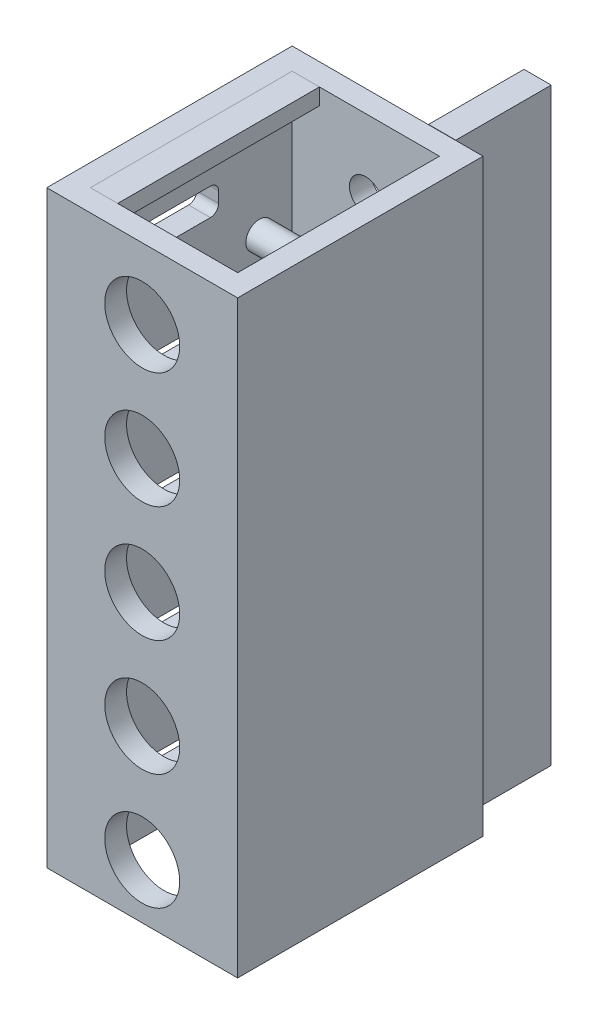
from build123d import *

# Parameters (mm, degrees)
SKETCH2_W           = 35
SKETCH2_H           = 105
BOSS_EXTRUDE1_DEPTH = 45
CUT_EXTRUDE1_REACH  = 133.011
SKETCH3_W           = 27
SKETCH3_H           = 37
SKETCH4_R           = 6.875
CUT_EXTRUDE2_DEPTH  = 10
SKETCH14_R          = 2.5
BOSS_EXTRUDE2_DEPTH = 10
CUT_EXTRUDE7_START  = -3.5
SKETCH15_R          = 2.5
SKETCH15_R_2        = 1.75
CUT_EXTRUDE7_DEPTH  = 1.5
SKETCH16_W          = 37
SKETCH16_H          = 3
BOSS_EXTRUDE4_DEPTH = 5
SKETCH17_W          = 35
SKETCH17_H          = 45
SKETCH17_W_2        = 27
SKETCH17_H_2        = 37
BOSS_EXTRUDE5_DEPTH = 3
SKETCH18_R          = 3
CUT_EXTRUDE8_DEPTH  = 10
CUT_EXTRUDE9_START  = -30
CUT_EXTRUDE9_DEPTH  = 10
SKETCH19_W          = 5
SKETCH19_H          = 108.046697757
BOSS_EXTRUDE6_DEPTH = 17.5


with BuildPart() as part:
    # Sketch2 → Boss-Extrude1 (new body)
    with BuildSketch(Plane.XY):
        with Locations((-46.639483312, 26.893418081)):
            Rectangle(SKETCH2_W, SKETCH2_H)
    extrude(amount=-BOSS_EXTRUDE1_DEPTH)

    # Sketch3 → Cut-Extrude1 (cut, up to next)
    with BuildSketch(Plane(origin=(0, 79.393418081, 0), x_dir=(1, 0, 0), z_dir=(0, 1, 0)), mode=Mode.PRIVATE) as cut_extrude1_sk1:
        with Locations((-46.639483312, 22.5)):
            Rectangle(SKETCH3_W, SKETCH3_H)
    cut_extrude1_tool1 = extrude(cut_extrude1_sk1.sketch, amount=-CUT_EXTRUDE1_REACH, mode=Mode.PRIVATE) & part.part
    add(cut_extrude1_tool1.solids().sort_by_distance((-46.639483, 79.393418, -22.5))[0], mode=Mode.SUBTRACT)

    # Sketch4 → Cut-Extrude2 (cut)
    with BuildSketch(Plane.XY):
        with Locations((-46.639483312, 69.393418081)):
            Circle(SKETCH4_R)
        with Locations((-46.639483312, 48.143418081)):
            Circle(SKETCH4_R)
        with Locations((-46.639483312, 26.893418081)):
            Circle(SKETCH4_R)
        with Locations((-46.639483312, 5.643418081)):
            Circle(SKETCH4_R)
        with Locations((-46.639483312, -15.606581919)):
            Circle(SKETCH4_R)
    extrude(amount=-CUT_EXTRUDE2_DEPTH, mode=Mode.SUBTRACT)

    # Sketch14 → Boss-Extrude2 (add)
    with BuildSketch(Plane(origin=(-60.139483312, 0, 0), x_dir=(0, 0, -1), z_dir=(1, 0, 0))):
        with Locations(Location((35, 59.393418081, 0), (0, 0, 270))):
            Circle(SKETCH14_R)
    extrude(amount=BOSS_EXTRUDE2_DEPTH)

    # Sketch15 → Cut-Extrude7 (cut)
    with BuildSketch(Plane(origin=(-50.139483312, 0, 0), x_dir=(0, 0, -1), z_dir=(1, 0, 0)).offset(CUT_EXTRUDE7_START)):
        with Locations(Location((35, 59.393418081, 0), (0, 0, 270))):
            Circle(SKETCH15_R)
        with Locations(Location((35, 59.393418081, 0), (0, 0, 90))):
            Circle(SKETCH15_R_2, mode=Mode.SUBTRACT)
    extrude(amount=CUT_EXTRUDE7_DEPTH, mode=Mode.SUBTRACT)

    # Sketch17 → Boss-Extrude5 (add)
    with BuildSketch(Plane(origin=(0, 79.393418081, 0), x_dir=(1, 0, 0), z_dir=(0, 1, 0))):
        with Locations((-46.639483312, 22.5)):
            Rectangle(SKETCH17_W, SKETCH17_H)
        with Locations((-46.639483312, 22.5)):
            Rectangle(SKETCH17_W_2, SKETCH17_H_2, mode=Mode.SUBTRACT)
    extrude(amount=BOSS_EXTRUDE5_DEPTH)

    # Sketch18 → Cut-Extrude8 (cut)
    with BuildSketch(Plane.XY.offset(-41)):
        with Locations((-46.639483312, 69.393418081)):
            Circle(SKETCH18_R)
        with Locations((-46.639483312, 48.143418081)):
            Circle(SKETCH18_R)
        with Locations((-46.639483312, 26.893418081)):
            Circle(SKETCH18_R)
        with Locations((-46.639483312, 5.643418081)):
            Circle(SKETCH18_R)
        with Locations((-46.639483312, -15.606581919)):
            Circle(SKETCH18_R)
    extrude(amount=-CUT_EXTRUDE8_DEPTH, mode=Mode.SUBTRACT)

    # Sketch12 → Cut-Extrude9 (cut)
    with BuildSketch(Plane(origin=(-29.139483312, 0, 0), x_dir=(0, 0, -1), z_dir=(1, 0, 0)).offset(CUT_EXTRUDE9_START)):
        with BuildLine():
            Line((9, 7.893418081), (26, 7.893418081))
            ThreePointArc((26, 7.893418081), (27.060660172, 7.454078252), (27.5, 6.393418081))
            Line((27.5, 6.393418081), (27.5, 4.393418081))
            ThreePointArc((27.5, 4.393418081), (27.060660172, 3.332757909), (26, 2.893418081))
            Line((26, 2.893418081), (9, 2.893418081))
            ThreePointArc((9, 2.893418081), (7.939339828, 3.332757909), (7.5, 4.393418081))
            Line((7.5, 4.393418081), (7.5, 6.393418081))
            ThreePointArc((7.5, 6.393418081), (7.939339828, 7.454078252), (9, 7.893418081))
        make_face()
        with BuildLine():
            Line((9, 29.143418081), (26, 29.143418081))
            ThreePointArc((26, 29.143418081), (27.060660172, 28.704078252), (27.5, 27.643418081))
            Line((27.5, 27.643418081), (27.5, 25.643418081))
            ThreePointArc((27.5, 25.643418081), (27.060660172, 24.582757909), (26, 24.143418081))
            Line((26, 24.143418081), (9, 24.143418081))
            ThreePointArc((9, 24.143418081), (7.939339828, 24.582757909), (7.5, 25.643418081))
            Line((7.5, 25.643418081), (7.5, 27.643418081))
            ThreePointArc((7.5, 27.643418081), (7.939339828, 28.704078252), (9, 29.143418081))
        make_face()
        with BuildLine():
            Line((9, 50.393418081), (26, 50.393418081))
            ThreePointArc((26, 50.393418081), (27.060660172, 49.954078252), (27.5, 48.893418081))
            Line((27.5, 48.893418081), (27.5, 46.893418081))
            ThreePointArc((27.5, 46.893418081), (27.060660172, 45.832757909), (26, 45.393418081))
            Line((26, 45.393418081), (9, 45.393418081))
            ThreePointArc((9, 45.393418081), (7.939339828, 45.832757909), (7.5, 46.893418081))
            Line((7.5, 46.893418081), (7.5, 48.893418081))
            ThreePointArc((7.5, 48.893418081), (7.939339828, 49.954078252), (9, 50.393418081))
        make_face()
        with BuildLine():
            Line((9, 71.643418081), (26, 71.643418081))
            ThreePointArc((26, 71.643418081), (27.060660172, 71.204078252), (27.5, 70.143418081))
            Line((27.5, 70.143418081), (27.5, 68.143418081))
            ThreePointArc((27.5, 68.143418081), (27.060660172, 67.082757909), (26, 66.643418081))
            Line((26, 66.643418081), (9, 66.643418081))
            ThreePointArc((9, 66.643418081), (7.939339828, 67.082757909), (7.5, 68.143418081))
            Line((7.5, 68.143418081), (7.5, 70.143418081))
            ThreePointArc((7.5, 70.143418081), (7.939339828, 71.204078252), (9, 71.643418081))
        make_face()
        with BuildLine():
            Line((9, -13.356581919), (26, -13.356581919))
            ThreePointArc((26, -13.356581919), (27.060660172, -13.795921748), (27.5, -14.856581919))
            Line((27.5, -14.856581919), (27.5, -16.856581919))
            ThreePointArc((27.5, -16.856581919), (27.060660172, -17.917242091), (26, -18.356581919))
            Line((26, -18.356581919), (9, -18.356581919))
            ThreePointArc((9, -18.356581919), (7.939339828, -17.917242091), (7.5, -16.856581919))
            Line((7.5, -16.856581919), (7.5, -14.856581919))
            ThreePointArc((7.5, -14.856581919), (7.939339828, -13.795921748), (9, -13.356581919))
        make_face()
    extrude(amount=-CUT_EXTRUDE9_DEPTH, mode=Mode.SUBTRACT)

    # Sketch19 → Boss-Extrude6 (add)
    with BuildSketch(Plane(origin=(0, 0, -45), x_dir=(-1, 0, 0), z_dir=(0, 0, -1))):
        with Locations((36.639483312, 28.41676696)):
            Rectangle(SKETCH19_W, SKETCH19_H)
    extrude(amount=BOSS_EXTRUDE6_DEPTH)


with BuildPart() as body_2:
    # Sketch16 → Boss-Extrude4 (new body)
    with BuildSketch(Plane(origin=(-60.139483312, 0, 0), x_dir=(0, 0, -1), z_dir=(1, 0, 0))):
        with Locations((22.5, 80.893418081)):
            Rectangle(SKETCH16_W, SKETCH16_H)
    extrude(amount=BOSS_EXTRUDE4_DEPTH)


solid = Compound([part.part, body_2.part])
